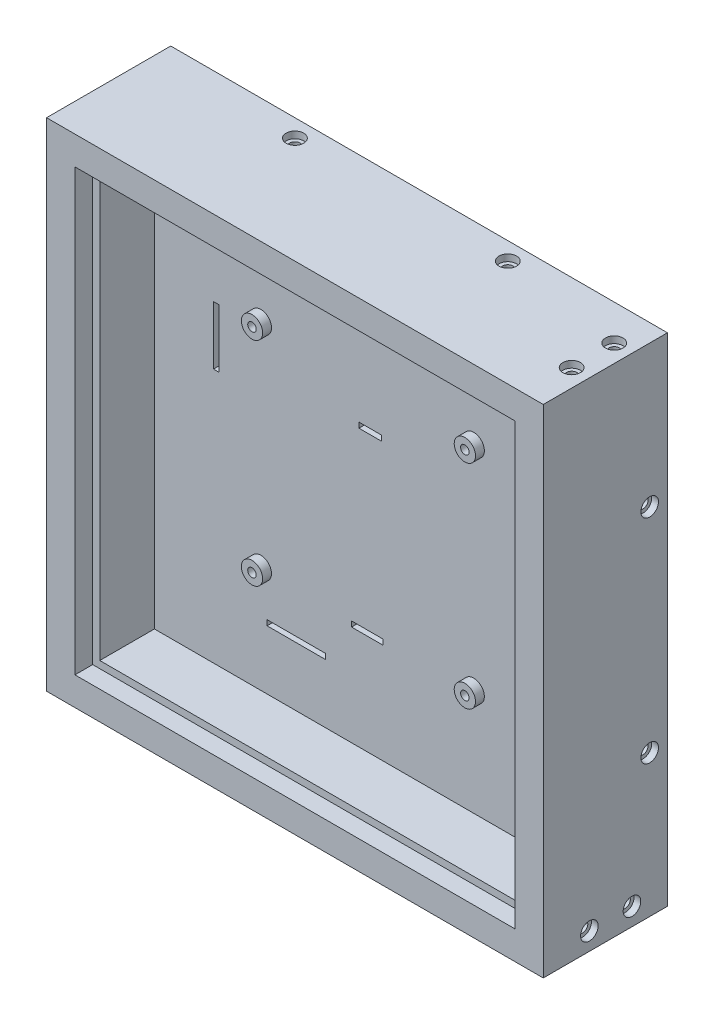
from build123d import *

# Parameters (mm, degrees)
SKETCH_1_W                     = 100
SKETCH_1_H                     = 100
EXTRUDE_1_DEPTH                = 1.6
SKETCH_4_W                     = 17.78
SKETCH_4_H                     = 2.5
SKETCH_4_W_2                   = 2.5
SKETCH_4_H_2                   = 17.78
EXTRUDE_2_DEPTH                = 2.5
SKETCH_5_W                     = 0.64
SKETCH_5_H                     = 0.64
EXTRUDE_3_DEPTH                = 6.1
SKETCH_6_W                     = 3.48
SKETCH_6_H                     = 3.48
EXTRUDE_4_DEPTH                = 2
SKETCH_7_W                     = 2
SKETCH_7_H                     = 4
SKETCH_7_W_2                   = 4
SKETCH_7_H_2                   = 2
EXTRUDE_5_DEPTH                = 1.1
SKETCH_8_W                     = 15.2
SKETCH_8_H                     = 7.4
EXTRUDE_6_DEPTH                = 2.65
SKETCH_9_W                     = 7.62
SKETCH_9_H                     = 2.5
EXTRUDE_7_DEPTH                = 2.5
SKETCH_11_W                    = 0.64
SKETCH_11_H                    = 0.64
EXTRUDE_8_DEPTH                = 6.1
SKETCH_42_W                    = 10.16
SKETCH_42_H                    = 2.5
EXTRUDE_14_DEPTH               = 2.5
SKETCH_43_W                    = 0.64
SKETCH_43_H                    = 0.64
EXTRUDE_15_DEPTH               = 6.1
SKETCH_15_W                    = 120
SKETCH_15_H                    = 120
EXTRUDE_11_DEPTH               = 15.4
SKETCH_16_W                    = 140
SKETCH_16_H                    = 140
EXTRUDE_12_DEPTH               = 30
SKETCH_17_W                    = 140
SKETCH_17_H                    = 140
SKETCH_17_W_2                  = 124
SKETCH_17_H_2                  = 124
EXTRUDE_13_DEPTH               = 5
SKETCH_18_W                    = 1.5
SKETCH_18_H                    = 16.48
SKETCH_18_W_2                  = 16.48
SKETCH_18_H_2                  = 1.5
SKETCH_18_W_3                  = 6.32
SKETCH_18_W_4                  = 8.86
CUT_EXTRUDE_1_DEPTH            = 7
HOLE_WIZARD_M2_5_1_D           = 2.9
HOLE_WIZARD_M2_5_1_DEPTH       = 20
HOLE_WIZARD_M2_5_1_CBORE_D     = 4.95
HOLE_WIZARD_M2_5_1_CBORE_DEPTH = 1.9
HOLE_WIZARD_M2_5_1_TIP         = 0.871247898
HOLE_WIZARD_M2_5_2_D           = 2.9
HOLE_WIZARD_M2_5_2_DEPTH       = 20
HOLE_WIZARD_M2_5_2_CBORE_D     = 4.95
HOLE_WIZARD_M2_5_2_CBORE_DEPTH = 1.9
HOLE_WIZARD_M2_5_2_TIP         = 0.871247898
HOLE_WIZARD_M2_5_3_D           = 2.9
HOLE_WIZARD_M2_5_3_DEPTH       = 20
HOLE_WIZARD_M2_5_3_CBORE_D     = 4.95
HOLE_WIZARD_M2_5_3_CBORE_DEPTH = 1.9
HOLE_WIZARD_M2_5_3_TIP         = 0.871247898
HOLE_WIZARD_M2_5_4_D           = 2.9
HOLE_WIZARD_M2_5_4_DEPTH       = 20
HOLE_WIZARD_M2_5_4_CBORE_D     = 4.95
HOLE_WIZARD_M2_5_4_CBORE_DEPTH = 1.9
HOLE_WIZARD_M2_5_4_TIP         = 0.871247898
HOLE_WIZARD_M2_5_5_D           = 2.9
HOLE_WIZARD_M2_5_5_DEPTH       = 20
HOLE_WIZARD_M2_5_5_CBORE_D     = 4.95
HOLE_WIZARD_M2_5_5_CBORE_DEPTH = 1.9
HOLE_WIZARD_M2_5_5_TIP         = 0.871247898
HOLE_WIZARD_M2_5_6_D           = 2.9
HOLE_WIZARD_M2_5_6_DEPTH       = 20
HOLE_WIZARD_M2_5_6_CBORE_D     = 4.95
HOLE_WIZARD_M2_5_6_CBORE_DEPTH = 1.9
HOLE_WIZARD_M2_5_6_TIP         = 0.871247898
HOLE_WIZARD_M2_5_7_D           = 2.9
HOLE_WIZARD_M2_5_7_DEPTH       = 20
HOLE_WIZARD_M2_5_7_CBORE_D     = 4.95
HOLE_WIZARD_M2_5_7_CBORE_DEPTH = 1.9
HOLE_WIZARD_M2_5_7_TIP         = 0.871247898
HOLE_WIZARD_M2_5_8_D           = 2.9
HOLE_WIZARD_M2_5_8_DEPTH       = 20
HOLE_WIZARD_M2_5_8_CBORE_D     = 4.95
HOLE_WIZARD_M2_5_8_CBORE_DEPTH = 1.9
HOLE_WIZARD_M2_5_8_TIP         = 0.871247898
SKETCH_44_R                    = 3
SKETCH_44_R_2                  = 1.2
EXTRUDE_16_DEPTH               = 2.5


with BuildPart() as part:
    # ｽｹｯﾁ1 → ﾎﾞｽ - 押し出し1 (new body)
    with BuildSketch(Plane.XY):
        Rectangle(SKETCH_1_W, SKETCH_1_H)
    extrude(amount=EXTRUDE_1_DEPTH)

    # ｽｹｯﾁ4 → ﾎﾞｽ - 押し出し2 (add)
    with BuildSketch(Plane(origin=(0, 0, 0), x_dir=(-1, 0, 0), z_dir=(0, 0, -1))):
        with Locations((20, -42.6)):
            Rectangle(SKETCH_4_W, SKETCH_4_H)
        with Locations((-42.6, -20)):
            Rectangle(SKETCH_4_W_2, SKETCH_4_H_2)
        with Locations((-20, 42.6)):
            Rectangle(SKETCH_4_W, SKETCH_4_H)
        with Locations((42.6, 20)):
            Rectangle(SKETCH_4_W_2, SKETCH_4_H_2)
    extrude(amount=EXTRUDE_2_DEPTH)

    # ｽｹｯﾁ5 → ﾎﾞｽ - 押し出し3 (add)
    with BuildSketch(Plane(origin=(0, 0, -2.5), x_dir=(-1, 0, 0), z_dir=(0, 0, -1))):
        with Locations((-20, 42.6)):
            Rectangle(SKETCH_5_W, SKETCH_5_H)
        with Locations((-17.46, 42.6)):
            Rectangle(SKETCH_5_W, SKETCH_5_H)
        with Locations((-14.92, 42.6)):
            Rectangle(SKETCH_5_W, SKETCH_5_H)
        with Locations((-12.38, 42.6)):
            Rectangle(SKETCH_5_W, SKETCH_5_H)
        with Locations((-22.54, 42.6)):
            Rectangle(SKETCH_5_W, SKETCH_5_H)
        with Locations((-25.08, 42.6)):
            Rectangle(SKETCH_5_W, SKETCH_5_H)
        with Locations((-27.62, 42.6)):
            Rectangle(SKETCH_5_W, SKETCH_5_H)
        with Locations((-42.6, -20)):
            Rectangle(SKETCH_5_W, SKETCH_5_H)
        with Locations((-42.6, -22.54)):
            Rectangle(SKETCH_5_W, SKETCH_5_H)
        with Locations((42.6, 20)):
            Rectangle(SKETCH_5_W, SKETCH_5_H)
        with Locations((-42.6, -25.08)):
            Rectangle(SKETCH_5_W, SKETCH_5_H)
        with Locations((-42.6, -27.62)):
            Rectangle(SKETCH_5_W, SKETCH_5_H)
        with Locations((-42.6, -17.46)):
            Rectangle(SKETCH_5_W, SKETCH_5_H)
        with Locations((-42.6, -14.92)):
            Rectangle(SKETCH_5_W, SKETCH_5_H)
        with Locations((-42.6, -12.38)):
            Rectangle(SKETCH_5_W, SKETCH_5_H)
        with Locations((42.6, 17.46)):
            Rectangle(SKETCH_5_W, SKETCH_5_H)
        with Locations((42.6, 14.92)):
            Rectangle(SKETCH_5_W, SKETCH_5_H)
        with Locations((42.6, 12.38)):
            Rectangle(SKETCH_5_W, SKETCH_5_H)
        with Locations((42.6, 22.54)):
            Rectangle(SKETCH_5_W, SKETCH_5_H)
        with Locations((42.6, 25.08)):
            Rectangle(SKETCH_5_W, SKETCH_5_H)
        with Locations((42.6, 27.62)):
            Rectangle(SKETCH_5_W, SKETCH_5_H)
        with Locations((20, -42.6)):
            Rectangle(SKETCH_5_W, SKETCH_5_H)
        with Locations((17.46, -42.6)):
            Rectangle(SKETCH_5_W, SKETCH_5_H)
        with Locations((14.92, -42.6)):
            Rectangle(SKETCH_5_W, SKETCH_5_H)
        with Locations((12.38, -42.6)):
            Rectangle(SKETCH_5_W, SKETCH_5_H)
        with Locations((22.54, -42.6)):
            Rectangle(SKETCH_5_W, SKETCH_5_H)
        with Locations((25.08, -42.6)):
            Rectangle(SKETCH_5_W, SKETCH_5_H)
        with Locations((27.62, -42.6)):
            Rectangle(SKETCH_5_W, SKETCH_5_H)
    extrude(amount=EXTRUDE_3_DEPTH)

    # ｽｹｯﾁ6 → ﾎﾞｽ - 押し出し4 (add)
    with BuildSketch(Plane.XY.offset(1.6)):
        with Locations((-35, -35)):
            Rectangle(SKETCH_6_W, SKETCH_6_H)
        with Locations((-35, 35)):
            Rectangle(SKETCH_6_W, SKETCH_6_H)
        with Locations((35, -35)):
            Rectangle(SKETCH_6_W, SKETCH_6_H)
        with Locations((35, 35)):
            Rectangle(SKETCH_6_W, SKETCH_6_H)
    extrude(amount=EXTRUDE_4_DEPTH)

    # ｽｹｯﾁ7 → ﾎﾞｽ - 押し出し5 (add)
    with BuildSketch(Plane.XY.offset(1.6)):
        with Locations((-37.5, 0)):
            Rectangle(SKETCH_7_W, SKETCH_7_H)
        with Locations((37.5, 0)):
            Rectangle(SKETCH_7_W, SKETCH_7_H)
        with Locations((0, 37.5)):
            Rectangle(SKETCH_7_W_2, SKETCH_7_H_2)
        with Locations((0, -37.5)):
            Rectangle(SKETCH_7_W_2, SKETCH_7_H_2)
        Rectangle(SKETCH_7_W, SKETCH_7_H)
    extrude(amount=EXTRUDE_5_DEPTH)

    # ｽｹｯﾁ8 → ﾎﾞｽ - 押し出し6 (add)
    with BuildSketch(Plane.XY.offset(1.6)):
        with Locations((0, -17)):
            Rectangle(SKETCH_8_W, SKETCH_8_H)
    extrude(amount=EXTRUDE_6_DEPTH)

    # ｽｹｯﾁ9 → ﾎﾞｽ - 押し出し7 (add)
    with BuildSketch(Plane(origin=(0, 0, 0), x_dir=(-1, 0, 0), z_dir=(0, 0, -1))):
        with Locations((-0.8, 18.58)):
            Rectangle(SKETCH_9_W, SKETCH_9_H)
    extrude(amount=EXTRUDE_7_DEPTH)

    # ｽｹｯﾁ11 → ﾎﾞｽ - 押し出し8 (add)
    with BuildSketch(Plane(origin=(0, 0, -2.5), x_dir=(-1, 0, 0), z_dir=(0, 0, -1))):
        with Locations((-0.8, 18.58)):
            Rectangle(SKETCH_11_W, SKETCH_11_H)
        with Locations((-3.34, 18.58)):
            Rectangle(SKETCH_11_W, SKETCH_11_H)
        with Locations((1.74, 18.58)):
            Rectangle(SKETCH_11_W, SKETCH_11_H)
    extrude(amount=EXTRUDE_8_DEPTH)

    # ｽｹｯﾁ42 → ﾎﾞｽ - 押し出し14 (add)
    with BuildSketch(Plane(origin=(0, 0, 0), x_dir=(-1, 0, 0), z_dir=(0, 0, -1))):
        with Locations((0, -31)):
            Rectangle(SKETCH_42_W, SKETCH_42_H)
    extrude(amount=EXTRUDE_14_DEPTH)

    # ｽｹｯﾁ43 → ﾎﾞｽ - 押し出し15 (add)
    with BuildSketch(Plane(origin=(0, 0, -2.5), x_dir=(-1, 0, 0), z_dir=(0, 0, -1))):
        with Locations((-3.81, -31)):
            Rectangle(SKETCH_43_W, SKETCH_43_H)
        with Locations((-1.27, -31)):
            Rectangle(SKETCH_43_W, SKETCH_43_H)
        with Locations((1.27, -31)):
            Rectangle(SKETCH_43_W, SKETCH_43_H)
        with Locations((3.81, -31)):
            Rectangle(SKETCH_43_W, SKETCH_43_H)
    extrude(amount=EXTRUDE_15_DEPTH)


with BuildPart() as body_2:
    # ｽｹｯﾁ15 → ﾎﾞｽ - 押し出し11 (new body)
    with BuildSketch(Plane(origin=(0, 0, -2.5), x_dir=(-1, 0, 0), z_dir=(0, 0, -1))):
        Rectangle(SKETCH_15_W, SKETCH_15_H)
    extrude(amount=-EXTRUDE_11_DEPTH)


with BuildPart() as body_3:
    # ｽｹｯﾁ16 → ﾎﾞｽ - 押し出し12 (new body)
    with BuildSketch(Plane.XY.offset(12.9)):
        Rectangle(SKETCH_16_W, SKETCH_16_H)
    extrude(amount=-EXTRUDE_12_DEPTH)

    # Combine 1: cut part, body 2
    add(part.part, mode=Mode.SUBTRACT)
    add(body_2.part, mode=Mode.SUBTRACT)

    # ｽｹｯﾁ17 → ﾎﾞｽ - 押し出し13 (add)
    with BuildSketch(Plane.XY.offset(12.9)):
        Rectangle(SKETCH_17_W, SKETCH_17_H)
        Rectangle(SKETCH_17_W_2, SKETCH_17_H_2, mode=Mode.SUBTRACT)
    extrude(amount=EXTRUDE_13_DEPTH)

    # ｽｹｯﾁ18 → ｶｯﾄ - 押し出し1 (cut)
    with BuildSketch(Plane.XY.offset(-2.5)):
        with Locations((-42.6, 20)):
            Rectangle(SKETCH_18_W, SKETCH_18_H)
        with Locations((-20, -42.6)):
            Rectangle(SKETCH_18_W_2, SKETCH_18_H_2)
        with Locations((42.6, -20)):
            Rectangle(SKETCH_18_W, SKETCH_18_H)
        with Locations((20, 42.6)):
            Rectangle(SKETCH_18_W_2, SKETCH_18_H_2)
        with Locations((0.8, 18.58)):
            Rectangle(SKETCH_18_W_3, SKETCH_18_H_2)
        with Locations((0, -31)):
            Rectangle(SKETCH_18_W_4, SKETCH_18_H_2)
    extrude(amount=-CUT_EXTRUDE_1_DEPTH, mode=Mode.SUBTRACT)

    # M2.5 丸平ねじ用座ぐり穴1
    with Locations(Plane(origin=(0, -70, 0), x_dir=(-1, 0, 0), z_dir=(0, -1, 0))):
        with Locations((65, 7.1), (65, -4.9)):
            CounterBoreHole(HOLE_WIZARD_M2_5_1_D / 2, HOLE_WIZARD_M2_5_1_CBORE_D / 2, HOLE_WIZARD_M2_5_1_CBORE_DEPTH, depth=HOLE_WIZARD_M2_5_1_DEPTH)
            with Locations((0, 0, -(HOLE_WIZARD_M2_5_1_DEPTH + HOLE_WIZARD_M2_5_1_TIP / 2))):  # 118° drill point
                Cone(0, HOLE_WIZARD_M2_5_1_D / 2, HOLE_WIZARD_M2_5_1_TIP, mode=Mode.SUBTRACT)

    # M2.5 丸平ねじ用座ぐり穴2
    with Locations(Plane.ZY.offset(70)):
        with Locations((4.9, 65), (-7.1, 65)):
            CounterBoreHole(HOLE_WIZARD_M2_5_2_D / 2, HOLE_WIZARD_M2_5_2_CBORE_D / 2, HOLE_WIZARD_M2_5_2_CBORE_DEPTH, depth=HOLE_WIZARD_M2_5_2_DEPTH)
            with Locations((0, 0, -(HOLE_WIZARD_M2_5_2_DEPTH + HOLE_WIZARD_M2_5_2_TIP / 2))):  # 118° drill point
                Cone(0, HOLE_WIZARD_M2_5_2_D / 2, HOLE_WIZARD_M2_5_2_TIP, mode=Mode.SUBTRACT)

    # M2.5 丸平ねじ用座ぐり穴3
    with Locations(Plane(origin=(0, 70, 0), x_dir=(1, 0, 0), z_dir=(0, 1, 0))):
        with Locations((65, 7.1), (65, -4.9)):
            CounterBoreHole(HOLE_WIZARD_M2_5_3_D / 2, HOLE_WIZARD_M2_5_3_CBORE_D / 2, HOLE_WIZARD_M2_5_3_CBORE_DEPTH, depth=HOLE_WIZARD_M2_5_3_DEPTH)
            with Locations((0, 0, -(HOLE_WIZARD_M2_5_3_DEPTH + HOLE_WIZARD_M2_5_3_TIP / 2))):  # 118° drill point
                Cone(0, HOLE_WIZARD_M2_5_3_D / 2, HOLE_WIZARD_M2_5_3_TIP, mode=Mode.SUBTRACT)

    # M2.5 丸平ねじ用座ぐり穴4
    with Locations(Plane(origin=(70, 0, 0), x_dir=(0, 0, -1), z_dir=(1, 0, 0))):
        with Locations((-4.9, -65), (7.1, -65)):
            CounterBoreHole(HOLE_WIZARD_M2_5_4_D / 2, HOLE_WIZARD_M2_5_4_CBORE_D / 2, HOLE_WIZARD_M2_5_4_CBORE_DEPTH, depth=HOLE_WIZARD_M2_5_4_DEPTH)
            with Locations((0, 0, -(HOLE_WIZARD_M2_5_4_DEPTH + HOLE_WIZARD_M2_5_4_TIP / 2))):  # 118° drill point
                Cone(0, HOLE_WIZARD_M2_5_4_D / 2, HOLE_WIZARD_M2_5_4_TIP, mode=Mode.SUBTRACT)

    # M2.5 丸平ねじ用座ぐり穴5
    with Locations(Plane(origin=(0, -70, 0), x_dir=(-1, 0, 0), z_dir=(0, -1, 0))):
        with Locations((30, 12.1), (-30, 12.1)):
            CounterBoreHole(HOLE_WIZARD_M2_5_5_D / 2, HOLE_WIZARD_M2_5_5_CBORE_D / 2, HOLE_WIZARD_M2_5_5_CBORE_DEPTH, depth=HOLE_WIZARD_M2_5_5_DEPTH)
            with Locations((0, 0, -(HOLE_WIZARD_M2_5_5_DEPTH + HOLE_WIZARD_M2_5_5_TIP / 2))):  # 118° drill point
                Cone(0, HOLE_WIZARD_M2_5_5_D / 2, HOLE_WIZARD_M2_5_5_TIP, mode=Mode.SUBTRACT)

    # M2.5 丸平ねじ用座ぐり穴6
    with Locations(Plane(origin=(70, 0, 0), x_dir=(0, 0, -1), z_dir=(1, 0, 0))):
        with Locations((12.1, 30), (12.1, -30)):
            CounterBoreHole(HOLE_WIZARD_M2_5_6_D / 2, HOLE_WIZARD_M2_5_6_CBORE_D / 2, HOLE_WIZARD_M2_5_6_CBORE_DEPTH, depth=HOLE_WIZARD_M2_5_6_DEPTH)
            with Locations((0, 0, -(HOLE_WIZARD_M2_5_6_DEPTH + HOLE_WIZARD_M2_5_6_TIP / 2))):  # 118° drill point
                Cone(0, HOLE_WIZARD_M2_5_6_D / 2, HOLE_WIZARD_M2_5_6_TIP, mode=Mode.SUBTRACT)

    # M2.5 丸平ねじ用座ぐり穴7
    with Locations(Plane(origin=(0, 70, 0), x_dir=(1, 0, 0), z_dir=(0, 1, 0))):
        with Locations((-30, 12.1), (30, 12.1)):
            CounterBoreHole(HOLE_WIZARD_M2_5_7_D / 2, HOLE_WIZARD_M2_5_7_CBORE_D / 2, HOLE_WIZARD_M2_5_7_CBORE_DEPTH, depth=HOLE_WIZARD_M2_5_7_DEPTH)
            with Locations((0, 0, -(HOLE_WIZARD_M2_5_7_DEPTH + HOLE_WIZARD_M2_5_7_TIP / 2))):  # 118° drill point
                Cone(0, HOLE_WIZARD_M2_5_7_D / 2, HOLE_WIZARD_M2_5_7_TIP, mode=Mode.SUBTRACT)

    # M2.5 丸平ねじ用座ぐり穴8
    with Locations(Plane.ZY.offset(70)):
        with Locations((-12.1, 30), (-12.1, -30)):
            CounterBoreHole(HOLE_WIZARD_M2_5_8_D / 2, HOLE_WIZARD_M2_5_8_CBORE_D / 2, HOLE_WIZARD_M2_5_8_CBORE_DEPTH, depth=HOLE_WIZARD_M2_5_8_DEPTH)
            with Locations((0, 0, -(HOLE_WIZARD_M2_5_8_DEPTH + HOLE_WIZARD_M2_5_8_TIP / 2))):  # 118° drill point
                Cone(0, HOLE_WIZARD_M2_5_8_D / 2, HOLE_WIZARD_M2_5_8_TIP, mode=Mode.SUBTRACT)

    # ｽｹｯﾁ44 → ﾎﾞｽ - 押し出し16 (add)
    # profile 1 of 4: a face of its own
    with BuildSketch(Plane.XY.offset(-2.5)):
        with Locations(Location((30, -30, 0), (0, 0, 180))):
            Circle(SKETCH_44_R)
        with Locations((30, -30)):
            Circle(SKETCH_44_R_2, mode=Mode.SUBTRACT)
    # profile 2 of 4: a face of its own
    with BuildSketch(Plane.XY.offset(-2.5)):
        with Locations(Location((-30, -30, 0), (0, 0, 180))):
            Circle(SKETCH_44_R)
        with Locations((-30, -30)):
            Circle(SKETCH_44_R_2, mode=Mode.SUBTRACT)
    # profile 3 of 4: a face of its own
    with BuildSketch(Plane.XY.offset(-2.5)):
        with Locations(Location((-30, 30, 0), (0, 0, 180))):
            Circle(SKETCH_44_R)
        with Locations((-30, 30)):
            Circle(SKETCH_44_R_2, mode=Mode.SUBTRACT)
    # profile 4 of 4: a face of its own
    with BuildSketch(Plane.XY.offset(-2.5)):
        with Locations(Location((30, 30, 0), (0, 0, 180))):
            Circle(SKETCH_44_R)
        with Locations((30, 30)):
            Circle(SKETCH_44_R_2, mode=Mode.SUBTRACT)
    extrude(amount=EXTRUDE_16_DEPTH)


solid = body_3.part
